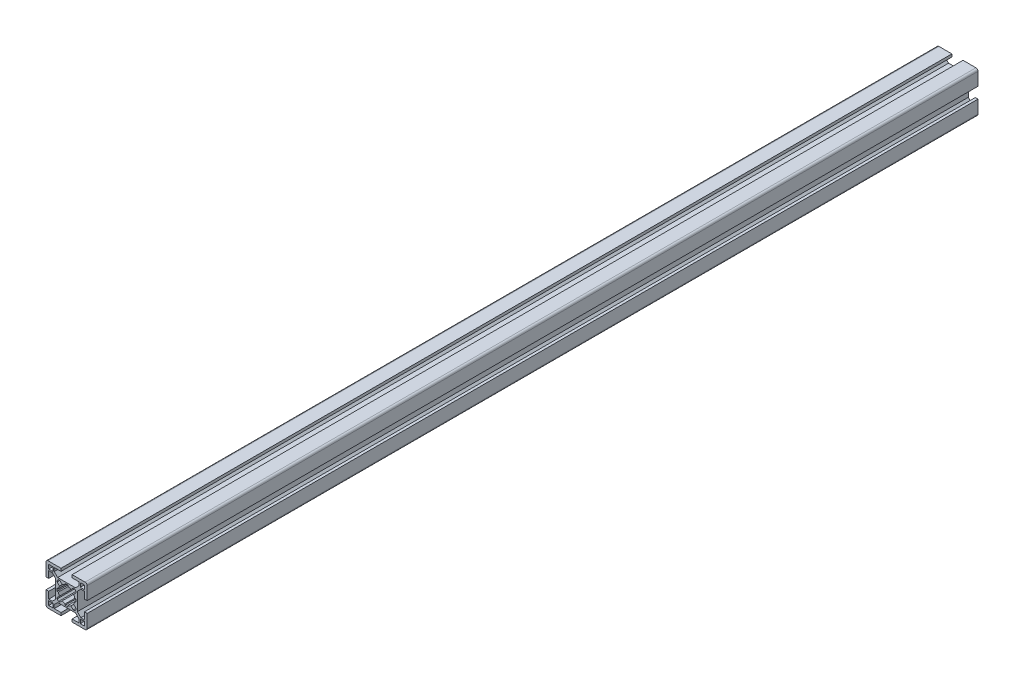
from build123d import *

# Parameters (mm, degrees)
ESBO_O1_W                = 3
ESBO_O1_H                = 3
RESSALTO_EXTRUS_O1_DEPTH = 325


with BuildPart() as part:
    # Esboço1 → Ressalto-extrusão1 (new, symmetric)
    with BuildSketch(Plane.XY):
        with BuildLine():
            Line((15, 13.5), (15, 4.05))
            Line((15, 4.05), (13, 4.05))
            Line((13, 4.05), (13, 9))
            Line((13, 9), (10.414213562, 9))
            Line((10.414213562, 9), (7.9, 6.485786438))
            Line((7.9, 6.485786438), (7.9, -7.36e-07))
            Line((7.9, -7.36e-07), (7.9, -6.485786438))
            Line((7.9, -6.485786438), (10.414213562, -9))
            Line((10.414213562, -9), (13, -9))
            Line((13, -9), (13, -4.05))
            Line((13, -4.05), (15, -4.05))
            Line((15, -4.05), (15, -13.5))
            ThreePointArc((15, -13.5), (14.560660172, -14.560660172), (13.5, -15))
            Line((13.5, -15), (4.05, -15))
            Line((4.05, -15), (4.05, -13))
            Line((4.05, -13), (9, -13))
            Line((9, -13), (9, -10.414213562))
            Line((9, -10.414213562), (6.485786438, -7.9))
            Line((6.485786438, -7.9), (-7.36e-07, -7.9))
            Line((-7.36e-07, -7.9), (-6.485786438, -7.9))
            Line((-6.485786438, -7.9), (-9, -10.414213562))
            Line((-9, -10.414213562), (-9, -13))
            Line((-9, -13), (-4.05, -13))
            Line((-4.05, -13), (-4.05, -15))
            Line((-4.05, -15), (-13.5, -15))
            ThreePointArc((-13.5, -15), (-14.560660172, -14.560660172), (-15, -13.5))
            Line((-15, -13.5), (-15, -4.05))
            Line((-15, -4.05), (-13, -4.05))
            Line((-13, -4.05), (-13, -9))
            Line((-13, -9), (-10.414213562, -9))
            Line((-10.414213562, -9), (-7.9, -6.485786438))
            Line((-7.9, -6.485786438), (-7.9, 7.36e-07))
            Line((-7.9, 7.36e-07), (-7.9, 6.485786438))
            Line((-7.9, 6.485786438), (-10.414213562, 9))
            Line((-10.414213562, 9), (-13, 9))
            Line((-13, 9), (-13, 4.05))
            Line((-13, 4.05), (-15, 4.05))
            Line((-15, 4.05), (-15, 13.5))
            ThreePointArc((-15, 13.5), (-14.560660172, 14.560660172), (-13.5, 15))
            Line((-13.5, 15), (-4.05, 15))
            Line((-4.05, 15), (-4.05, 13))
            Line((-4.05, 13), (-9, 13))
            Line((-9, 13), (-9, 10.414213562))
            Line((-9, 10.414213562), (-6.485786438, 7.9))
            Line((-6.485786438, 7.9), (7.36e-07, 7.9))
            Line((7.36e-07, 7.9), (6.485786438, 7.9))
            Line((6.485786438, 7.9), (9, 10.414213562))
            Line((9, 10.414213562), (9, 13))
            Line((9, 13), (4.05, 13))
            Line((4.05, 13), (4.05, 15))
            Line((4.05, 15), (13.5, 15))
            ThreePointArc((13.5, 15), (14.560660172, 14.560660172), (15, 13.5))
        make_face()
        with Locations((-11.5, 11.5)):
            Rectangle(ESBO_O1_W, ESBO_O1_H, mode=Mode.SUBTRACT)
        with BuildLine():
            Line((-6.9, 1.000000736), (-6.9, 7.36e-07))
            Line((-6.9, 7.36e-07), (-6.9, -1.000000736))
            Line((-6.9, -1.000000736), (-5.966782929, -1.000000736))
            ThreePointArc((-5.966782929, -1.000000736), (-5.665339038, -2.122836212), (-5.154690025, -3.167281286))
            Line((-5.154690025, -3.167281286), (-6.9, -4.91259126))
            Line((-6.9, -4.91259126), (-6.9, -5.827922061))
            Line((-6.9, -5.827922061), (-5.827922061, -6.9))
            Line((-5.827922061, -6.9), (-4.91259126, -6.9))
            Line((-4.91259126, -6.9), (-3.167281286, -5.154690025))
            ThreePointArc((-3.167281286, -5.154690025), (-2.122836212, -5.665339038), (-1.000000736, -5.966782929))
            Line((-1.000000736, -5.966782929), (-1.000000736, -6.9))
            Line((-1.000000736, -6.9), (-7.36e-07, -6.9))
            Line((-7.36e-07, -6.9), (1.000000736, -6.9))
            Line((1.000000736, -6.9), (1.000000736, -5.966782929))
            ThreePointArc((1.000000736, -5.966782929), (2.122836212, -5.665339038), (3.167281286, -5.154690025))
            Line((3.167281286, -5.154690025), (4.91259126, -6.9))
            Line((4.91259126, -6.9), (5.827922061, -6.9))
            Line((5.827922061, -6.9), (6.9, -5.827922061))
            Line((6.9, -5.827922061), (6.9, -4.91259126))
            Line((6.9, -4.91259126), (5.154690025, -3.167281286))
            ThreePointArc((5.154690025, -3.167281286), (5.665339038, -2.122836212), (5.966782929, -1.000000736))
            Line((5.966782929, -1.000000736), (6.9, -1.000000736))
            Line((6.9, -1.000000736), (6.9, -7.36e-07))
            Line((6.9, -7.36e-07), (6.9, 1.000000736))
            Line((6.9, 1.000000736), (5.966782929, 1.000000736))
            ThreePointArc((5.966782929, 1.000000736), (5.665339038, 2.122836212), (5.154690025, 3.167281286))
            Line((5.154690025, 3.167281286), (6.9, 4.91259126))
            Line((6.9, 4.91259126), (6.9, 5.827922061))
            Line((6.9, 5.827922061), (5.827922061, 6.9))
            Line((5.827922061, 6.9), (4.91259126, 6.9))
            Line((4.91259126, 6.9), (3.167281286, 5.154690025))
            ThreePointArc((3.167281286, 5.154690025), (2.122836212, 5.665339038), (1.000000736, 5.966782929))
            Line((1.000000736, 5.966782929), (1.000000736, 6.9))
            Line((1.000000736, 6.9), (7.36e-07, 6.9))
            Line((7.36e-07, 6.9), (-1.000000736, 6.9))
            Line((-1.000000736, 6.9), (-1.000000736, 5.966782929))
            ThreePointArc((-1.000000736, 5.966782929), (-2.122836212, 5.665339038), (-3.167281286, 5.154690025))
            Line((-3.167281286, 5.154690025), (-4.91259126, 6.9))
            Line((-4.91259126, 6.9), (-5.827922061, 6.9))
            Line((-5.827922061, 6.9), (-6.9, 5.827922061))
            Line((-6.9, 5.827922061), (-6.9, 4.91259126))
            Line((-6.9, 4.91259126), (-5.154690025, 3.167281286))
            ThreePointArc((-5.154690025, 3.167281286), (-5.665339038, 2.122836212), (-5.966782929, 1.000000736))
            Line((-5.966782929, 1.000000736), (-6.9, 1.000000736))
        make_face(mode=Mode.SUBTRACT)
        with Locations((11.5, 11.5)):
            Rectangle(ESBO_O1_W, ESBO_O1_H, mode=Mode.SUBTRACT)
        with Locations((11.5, -11.5)):
            Rectangle(ESBO_O1_W, ESBO_O1_H, mode=Mode.SUBTRACT)
        with Locations((-11.5, -11.5)):
            Rectangle(ESBO_O1_W, ESBO_O1_H, mode=Mode.SUBTRACT)
    extrude(amount=RESSALTO_EXTRUS_O1_DEPTH, both=True)


solid = part.part
